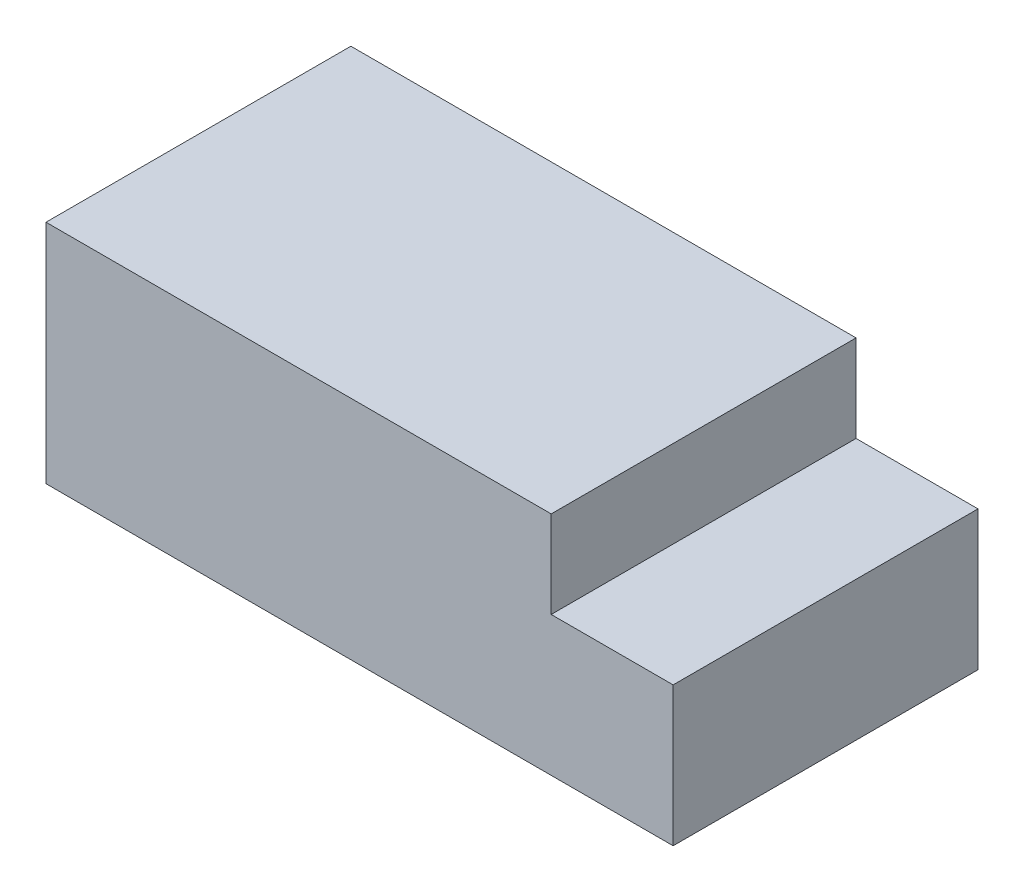
from build123d import *

# Parameters (mm, degrees)
SKETCH1_W           = 29
SKETCH1_H           = 17.5
BOSS_EXTRUDE1_DEPTH = 6.5
SKETCH2_W           = 17.5
SKETCH2_H           = 8
BOSS_EXTRUDE2_DEPTH = 7


with BuildPart() as part:
    # Sketch1 → Boss-Extrude1 (new, symmetric)
    with BuildSketch(Plane(origin=(0, 0, 0), x_dir=(1, 0, 0), z_dir=(0, 1, 0))):
        Rectangle(SKETCH1_W, SKETCH1_H)
    extrude(amount=BOSS_EXTRUDE1_DEPTH, both=True)

    # Sketch2 → Boss-Extrude2 (add)
    with BuildSketch(Plane(origin=(14.5, 0, 0), x_dir=(0, 0, -1), z_dir=(1, 0, 0))):
        with Locations((0, -2.5)):
            Rectangle(SKETCH2_W, SKETCH2_H)
    extrude(amount=BOSS_EXTRUDE2_DEPTH)


solid = part.part
